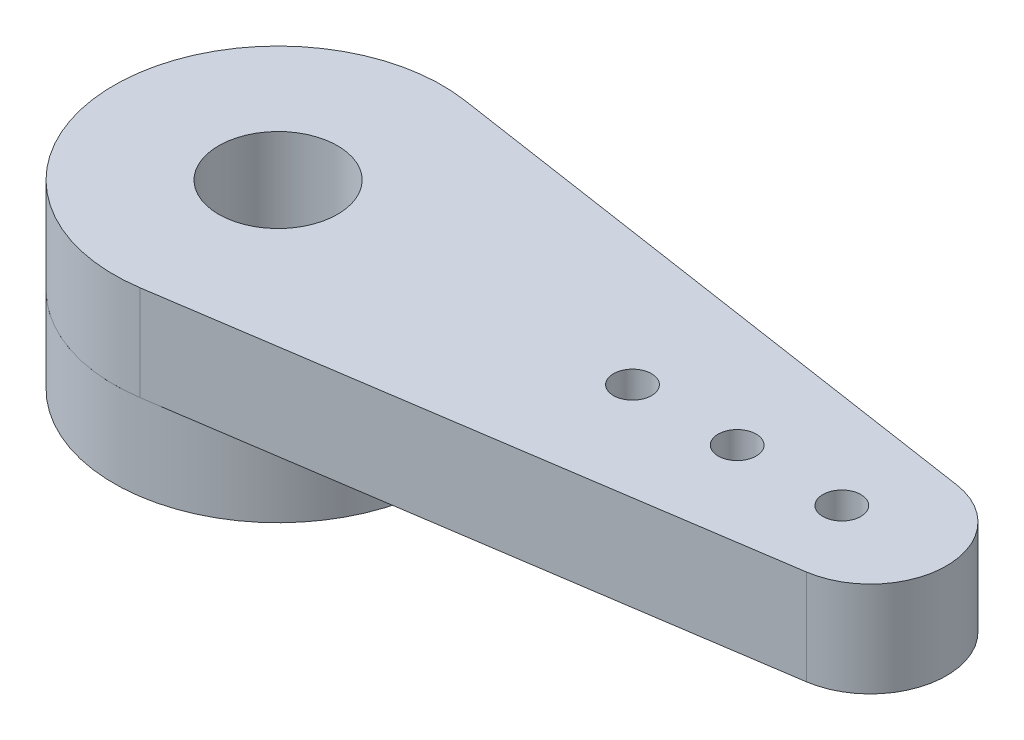
from build123d import *

# Parameters (mm, degrees)
SKETCH1_R           = 0.4
SKETCH1_R_2         = 1.25
BOSS_EXTRUDE1_DEPTH = 2
SKETCH2_R           = 3.45
SKETCH2_R_2         = 2.25
BOSS_EXTRUDE2_DEPTH = 1.8


with BuildPart() as part:
    # Sketch1 → Boss-Extrude1 (new body)
    with BuildSketch(Plane(origin=(0, 0, 0), x_dir=(1, 0, 0), z_dir=(0, 1, 0))):
        with BuildLine():
            Line((0.512650602, 3.411698896), (12.687751004, 1.582237169))
            ThreePointArc((12.687751004, 1.582237169), (14.05, 0), (12.687751004, -1.582237169))
            Line((12.687751004, -1.582237169), (0.512650602, -3.411698896))
            ThreePointArc((0.512650602, -3.411698896), (-3.45, 0), (0.512650602, 3.411698896))
        make_face()
        with Locations(Location((7.45, 0, 0), (0, 0, 270))):
            Circle(SKETCH1_R, mode=Mode.SUBTRACT)
        with Locations(Location((9.65, 0, 0), (0, 0, 270))):
            Circle(SKETCH1_R, mode=Mode.SUBTRACT)
        with Locations(Location((11.85, 0, 0), (0, 0, 270))):
            Circle(SKETCH1_R, mode=Mode.SUBTRACT)
        with Locations(Location((0, 0, 0), (0, 0, 270))):
            Circle(SKETCH1_R_2, mode=Mode.SUBTRACT)
    extrude(amount=BOSS_EXTRUDE1_DEPTH)


with BuildPart() as body_2:
    # Sketch2 → Boss-Extrude2 (new body)
    with BuildSketch(Plane.XZ):
        with Locations(Location((0, 0, 0), (0, 0, 270))):
            Circle(SKETCH2_R)
        with Locations(Location((0, 0, 0), (0, 0, 270))):
            Circle(SKETCH2_R_2, mode=Mode.SUBTRACT)
    extrude(amount=BOSS_EXTRUDE2_DEPTH)


solid = Compound([part.part, body_2.part])
